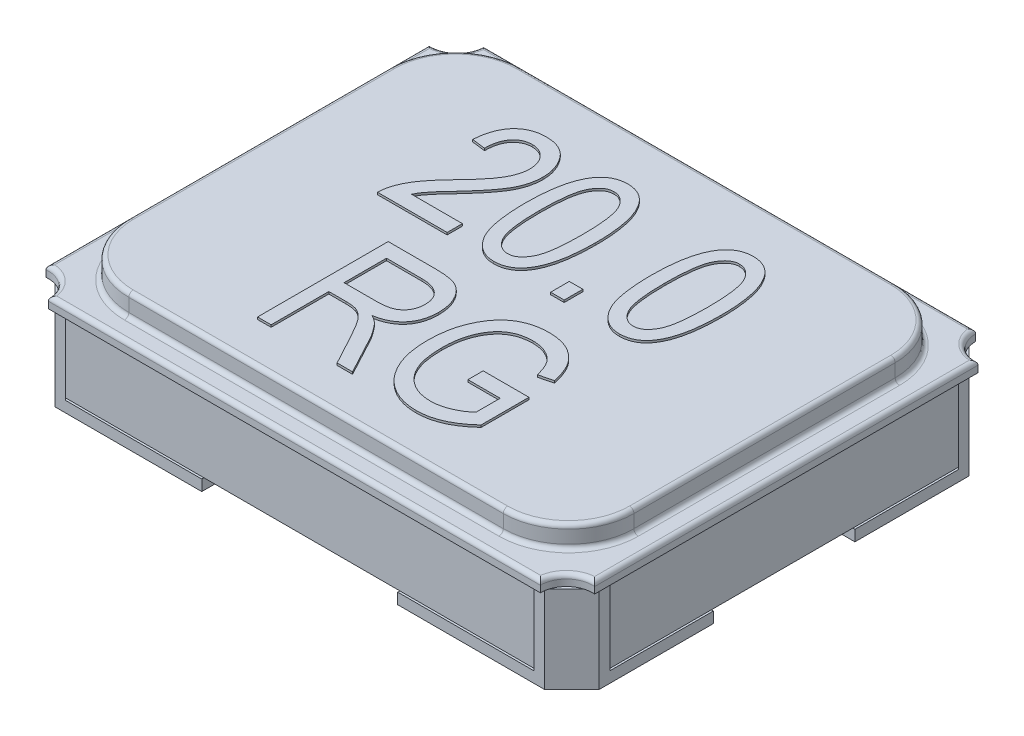
from build123d import *

# Parameters (mm, degrees)
EXTRUDE_2_DEPTH   = 0.05
EXTRUDE_2_2_DEPTH = 0.05
EXTRUDE_2_3_DEPTH = 0.05
EXTRUDE_2_4_DEPTH = 0.05
EXTRUDE_4_DEPTH   = 0.35
EXTRUDE_6_DEPTH   = 0.35
EXTRUDE_9_DEPTH   = 0.05
SKETCH_6_W        = 2.32
SKETCH_6_H        = 1.8
EXTRUDE_10_DEPTH  = 0.1
FILLET_2_R        = 0.3
FILLET_3_R        = 0.02
SKETCH_7_W        = 0.062337663
SKETCH_7_H        = 0.085714286
EXTRUDE_11_DEPTH  = 0.01


with BuildPart() as part:
    # Эскиз2 → Вытянуть2 (new body)
    with BuildSketch(Plane(origin=(0, 0, 0), x_dir=(1, 0, 0), z_dir=(0, 1, 0))):
        Polygon((-1.25, 0.325), (-0.45, 0.325), (-0.45, 0.975), (-1.125, 0.975), (-1.25, 0.85), align=None)
    extrude(amount=EXTRUDE_2_DEPTH)



with BuildPart() as body_2:
    # Эскиз2 → Extrude 2 2 (new body)
    with BuildSketch(Plane(origin=(0, 0, 0), x_dir=(1, 0, 0), z_dir=(0, 1, 0))):
        Polygon((0.45, 0.325), (0.45, 0.975), (1.125, 0.975), (1.25, 0.85), (1.25, 0.325), align=None)
    extrude(amount=EXTRUDE_2_2_DEPTH)


with BuildPart() as body_3:
    # Эскиз2 → Extrude 2 3 (new body)
    with BuildSketch(Plane(origin=(0, 0, 0), x_dir=(1, 0, 0), z_dir=(0, 1, 0))):
        Polygon((-1.25, -0.85), (-1.25, -0.325), (-0.734, -0.325), (-0.45, -0.55575), (-0.45, -0.975), (-1.125, -0.975), align=None)
    extrude(amount=EXTRUDE_2_3_DEPTH)


with BuildPart() as body_4:
    # Эскиз2 → Extrude 2 4 (new body)
    with BuildSketch(Plane(origin=(0, 0, 0), x_dir=(1, 0, 0), z_dir=(0, 1, 0))):
        Polygon((1.25, -0.325), (0.45, -0.325), (0.45, -0.975), (1.125, -0.975), (1.25, -0.85), align=None)
    extrude(amount=EXTRUDE_2_4_DEPTH)


with BuildPart() as part_1:
    add(part.part)

    add(body_2.part)  # Вытянуть4 merges body 2

    add(body_3.part)  # Вытянуть4 merges body 3

    add(body_4.part)  # Вытянуть4 merges body 4
    # Эскиз3 → Вытянуть4 (add)
    with BuildSketch(Plane(origin=(-0.45, 0.05, 0.975), x_dir=(-1, 0, 0), z_dir=(0, 1, 0))):
        Polygon((0.8, -1.825), (0.675, -1.95), (0.625, -1.95), (0.8, -1.775), align=None)
        Polygon((-1.7, -1.775), (-1.7, -1.825), (-1.575, -1.95), (-1.525, -1.95), align=None)
        Polygon((-1.7, -0.125), (-1.575, 0), (-1.525, 0), (-1.7, -0.175), align=None)
        Polygon((0.8, -0.175), (0.8, -0.125), (0.675, 0), (0.625, 0), align=None)
    extrude(amount=EXTRUDE_4_DEPTH)



with BuildPart() as body_2_2:
    # Эскиз4 → Вытянуть6 (new body)
    with BuildSketch(Plane(origin=(-0.45, 0.05, 0.975), x_dir=(-1, 0, 0), z_dir=(0, 1, 0))):
        Polygon((-1.690494047, -1.784505953), (-1.53909114, -1.93590886), (0.65, -1.925), (0.79, -1.785), (0.79, -0.165), (0.635, -0.01), (-1.535, -0.01), (-1.690494047, -0.165494047), align=None)
    extrude(amount=EXTRUDE_6_DEPTH)


with BuildPart() as part_2:
    add(part_1.part)

    add(body_2_2.part)  # Вытянуть9 merges body 2 2
    # Эскиз5 → Вытянуть9 (add)
    with BuildSketch(Plane(origin=(0, 0.4, 0.965), x_dir=(-1, 0, 0), z_dir=(0, 1, 0))):
        with BuildLine():
            Line((1.13, 0.035), (-1.13, 0.035))
            ThreePointArc((-1.13, 0.035), (-1.168759616, -0.053317609), (-1.26, -0.084582607))
            Line((-1.26, -0.084582607), (-1.26, -1.845417393))
            ThreePointArc((-1.26, -1.845417393), (-1.168759616, -1.876682391), (-1.13, -1.965))
            Line((-1.13, -1.965), (1.13, -1.965))
            ThreePointArc((1.13, -1.965), (1.168759616, -1.876682391), (1.26, -1.845417393))
            Line((1.26, -1.845417393), (1.26, -0.084582607))
            ThreePointArc((1.26, -0.084582607), (1.168759616, -0.053317609), (1.13, 0.035))
        make_face()
    extrude(amount=EXTRUDE_9_DEPTH)

    # Эскиз6 → Вытянуть10 (add)
    with BuildSketch(Plane(origin=(0, 0.45, 0), x_dir=(1, 0, 0), z_dir=(0, 1, 0))):
        Rectangle(SKETCH_6_W, SKETCH_6_H)
    extrude(amount=EXTRUDE_10_DEPTH)

    # Скругление2
    fillet_2_edges = [part_2.edges().sort_by_distance(p)[0] for p in [
        (-1.16, 0.5, -0.9),
        (-1.16, 0.5, 0.9),
        (1.16, 0.5, 0.9),
        (1.16, 0.5, -0.9),
    ]]
    fillet(fillet_2_edges, radius=FILLET_2_R)

    # Скругление3
    fillet_3_edges = [part_2.edges().sort_by_distance(p)[0] for p in [
        (0, 0.45, -0.9),
        (0, 0.55, -0.9),
        (1.16, 0.45, 0),
        (1.16, 0.55, 0),
        (-1.16, 0.55, 0),
        (0, 0.55, 0.9),
        (-1.072132034, 0.55, 0.812132034),
        (-1.072132034, 0.55, -0.812132034),
        (1.072132034, 0.55, 0.812132034),
        (1.072132034, 0.55, -0.812132034),
        (0, 0.45, 0.9),
        (-1.16, 0.45, 0),
        (1.072132034, 0.45, -0.812132034),
        (1.072132034, 0.45, 0.812132034),
        (-1.072132034, 0.45, -0.812132034),
        (-1.072132034, 0.45, 0.812132034),
        (-1.168759616, 0.45, 0.911682391),
        (0, 0.45, 1),
        (1.168759616, 0.45, 0.911682391),
        (1.26, 0.45, 0),
        (1.168759616, 0.45, -0.911682391),
        (0, 0.45, -1),
        (-1.168759616, 0.45, -0.911682391),
        (-1.26, 0.45, 0),
    ]]
    fillet(fillet_3_edges, radius=FILLET_3_R)

    # Эскиз7 → Вытянуть11 (add)
    # profile 1 of 6: a face of its own
    with BuildSketch(Plane(origin=(0, 0.55, 0), x_dir=(-1, 0, 0), z_dir=(0, 1, 0))):
        with BuildLine():
            Line((0.357321209, -0.129572333), (0.357321209, -0.059442463))
            Line((0.357321209, -0.059442463), (0.676801728, -0.059442463))
            add(Edge.make_bspline(
                [(0.676801728, -0.059442463), (0.676816521, -0.063096523), (0.67684649, -0.070499707), (0.67585011, -0.081786516), (0.673802963, -0.093346584), (0.671188963, -0.105334125), (0.667482605, -0.117591483), (0.662945301, -0.130178185), (0.65759182, -0.143063022), (0.651322824, -0.156321793), (0.643999464, -0.170083755), (0.635152749, -0.184282726), (0.625043347, -0.199182487), (0.61342633, -0.214597237), (0.600510699, -0.230673489), (0.586232714, -0.247336784), (0.570652004, -0.264678682), (0.559548992, -0.276197149), (0.553830949, -0.282129151)],
                knots=[0, 0, 0, 0, 0.672196011, 1.361880106, 2.081368845, 2.831486093, 3.618364569, 4.435734711, 5.292876118, 6.184871288, 7.133796945, 8.159796293, 9.26180684, 10.446293416, 11.710635831, 13.056147575, 14.483918136, 16, 16, 16, 16], degree=3))
            add(Edge.make_bspline(
                [(0.553830949, -0.282129151), (0.547186493, -0.289000984), (0.534393111, -0.302232163), (0.516393988, -0.321773797), (0.500017502, -0.339919892), (0.485672479, -0.357094986), (0.472816366, -0.372779195), (0.461934396, -0.387477783), (0.452791596, -0.40089921), (0.443159894, -0.416895148), (0.433870902, -0.435828175), (0.425915042, -0.458008816), (0.420604634, -0.479363677), (0.419967988, -0.493464469), (0.419658871, -0.50031097)],
                knots=[0, 0, 0, 0, 1.312411154, 2.526945595, 3.64776648, 4.668054202, 5.599250703, 6.431783916, 7.178281792, 7.828133401, 8.994463432, 10.06613924, 11.061032878, 12, 12, 12, 12], degree=3))
            add(Edge.make_bspline(
                [(0.419658871, -0.50031097), (0.419700996, -0.504090661), (0.41978327, -0.511472793), (0.421245337, -0.522246305), (0.423237349, -0.532532448), (0.426199497, -0.542250746), (0.429811206, -0.551527994), (0.434525527, -0.560140103), (0.439837386, -0.568366659), (0.446059459, -0.575870788), (0.452854652, -0.582642523), (0.460034645, -0.588704286), (0.467718628, -0.593659056), (0.475748726, -0.597763197), (0.484172923, -0.600903455), (0.492969968, -0.603256376), (0.502166787, -0.60459308), (0.508412861, -0.604794695), (0.511582572, -0.604897009)],
                knots=[0, 0, 0, 0, 1.164230772, 2.273864494, 3.346188882, 4.391230338, 5.401926325, 6.409519631, 7.412440917, 8.416921958, 9.407829897, 10.36743554, 11.307926244, 12.220023309, 13.142615873, 14.07432652, 15.022773578, 16, 16, 16, 16], degree=3))
            add(Edge.make_bspline(
                [(0.511582572, -0.604897009), (0.515000078, -0.60482542), (0.521671204, -0.604685675), (0.531393779, -0.602945008), (0.540713753, -0.600623717), (0.549513959, -0.597016166), (0.5579072, -0.592476575), (0.565760696, -0.586877014), (0.57319112, -0.580310265), (0.58009113, -0.572769325), (0.586453474, -0.564312349), (0.591771569, -0.554795075), (0.596470816, -0.54452245), (0.600167429, -0.533320988), (0.603137319, -0.521275566), (0.605102153, -0.508355186), (0.606549344, -0.494580504), (0.606630269, -0.485095983), (0.606671858, -0.480221684)],
                knots=[0, 0, 0, 0, 0.928796924, 1.81305423, 2.681021375, 3.538312184, 4.39332334, 5.272808506, 6.156996835, 7.087171748, 8.050270225, 9.029757968, 10.048018956, 11.120254801, 12.234609712, 13.420296851, 14.674234959, 16, 16, 16, 16], degree=3))
            Line((0.606671858, -0.480221684), (0.669009521, -0.488013892))
            add(Edge.make_bspline(
                [(0.669009521, -0.488013892), (0.668367114, -0.49524769), (0.667120816, -0.509281588), (0.663850625, -0.529597692), (0.659313545, -0.548447917), (0.653924775, -0.566017964), (0.647155522, -0.582097881), (0.639536587, -0.596982074), (0.630626982, -0.610411651), (0.620612728, -0.622409122), (0.609577743, -0.632929291), (0.597722675, -0.642072677), (0.585103306, -0.650002626), (0.571542025, -0.656297331), (0.557128539, -0.661205459), (0.541916568, -0.664714559), (0.525845207, -0.66680733), (0.514876191, -0.66709012), (0.509269261, -0.667234671)],
                knots=[0, 0, 0, 0, 1.296016433, 2.514330702, 3.668705393, 4.754684394, 5.790583066, 6.778804856, 7.735156204, 8.660808185, 9.562568342, 10.450784178, 11.329227516, 12.217177451, 13.112894374, 14.042449809, 14.999377131, 16, 16, 16, 16], degree=3))
            add(Edge.make_bspline(
                [(0.509269261, -0.667234671), (0.503215025, -0.66705828), (0.491426421, -0.666714819), (0.474274014, -0.664416802), (0.458228551, -0.660455806), (0.443406331, -0.654631952), (0.429646213, -0.647479615), (0.417072647, -0.638596687), (0.405698729, -0.628036297), (0.39558595, -0.615998276), (0.386646347, -0.603007525), (0.37884661, -0.589422163), (0.372080794, -0.575469128), (0.366793159, -0.560992675), (0.362377409, -0.546187218), (0.359603341, -0.53082829), (0.357650417, -0.515093115), (0.357431565, -0.504456783), (0.357321209, -0.499093437)],
                knots=[0, 0, 0, 0, 1.141316638, 2.222333051, 3.255980828, 4.24919085, 5.217781249, 6.173073686, 7.14226832, 8.135684626, 9.131102602, 10.111468148, 11.086834621, 12.050425614, 13.014198859, 13.995608887, 14.989290351, 16, 16, 16, 16], degree=3))
            add(Edge.make_bspline(
                [(0.357321209, -0.499093437), (0.357424886, -0.494261203), (0.35763089, -0.484659692), (0.358979233, -0.470335356), (0.361334792, -0.456196977), (0.364475501, -0.442151812), (0.368608214, -0.428272821), (0.373784157, -0.414603169), (0.379762018, -0.401070547), (0.386686403, -0.387416002), (0.395026467, -0.373338215), (0.404927948, -0.358366408), (0.416536438, -0.342338924), (0.429706838, -0.325178689), (0.444459309, -0.306889566), (0.460923068, -0.287544532), (0.479065407, -0.267120247), (0.491836253, -0.253253344), (0.498433222, -0.24609019)],
                knots=[0, 0, 0, 0, 0.780472836, 1.550777384, 2.321277132, 3.094115446, 3.873899828, 4.657970281, 5.45330333, 6.262401287, 7.129160449, 8.094534006, 9.160566029, 10.324774858, 11.58803391, 12.955259569, 14.427194379, 16, 16, 16, 16], degree=3))
            add(Edge.make_bspline(
                [(0.498433222, -0.24609019), (0.502625439, -0.241637041), (0.510637103, -0.233126716), (0.521905602, -0.220782256), (0.532231382, -0.209711405), (0.54126346, -0.19963391), (0.549295121, -0.19076562), (0.555897036, -0.182816301), (0.561573557, -0.176173228), (0.56985478, -0.1655282), (0.580305975, -0.150512912), (0.5875765, -0.136391552), (0.591087443, -0.129572333)],
                knots=[0, 0, 0, 0, 1.227426371, 2.345710398, 3.354421158, 4.265580894, 5.061720194, 5.755250507, 6.339260457, 6.815034732, 8.461977265, 10, 10, 10, 10], degree=3))
            Line((0.591087443, -0.129572333), (0.357321209, -0.129572333))
        make_face()
    # profile 2 of 6: a face of its own
    with BuildSketch(Plane(origin=(0, 0.55, 0), x_dir=(-1, 0, 0), z_dir=(0, 1, 0))):
        with BuildLine():
            add(Edge.make_bspline(
                [(0.294983547, -0.359198957), (0.294884569, -0.371458245), (0.294692379, -0.395262834), (0.292705706, -0.429788615), (0.289572998, -0.462043654), (0.285310134, -0.491983415), (0.279550263, -0.519616718), (0.272727094, -0.545010269), (0.26444496, -0.568092933), (0.255013592, -0.588883378), (0.244311345, -0.607300741), (0.232302013, -0.623287074), (0.219157823, -0.636973736), (0.204609456, -0.648078008), (0.188879575, -0.656688701), (0.171935298, -0.662845149), (0.153790276, -0.666569831), (0.141267513, -0.667010055), (0.134878027, -0.667234671)],
                knots=[0, 0, 0, 0, 1.522177082, 2.955701814, 4.292601031, 5.54555501, 6.7088804, 7.795771162, 8.808034672, 9.750647735, 10.627079958, 11.44753433, 12.228026558, 12.97593222, 13.711165822, 14.446140298, 15.20717461, 16, 16, 16, 16], degree=3))
            add(Edge.make_bspline(
                [(0.134878027, -0.667234671), (0.12918032, -0.667069707), (0.117983968, -0.666745542), (0.101726679, -0.663535616), (0.086311011, -0.658750451), (0.071961166, -0.651688755), (0.058514779, -0.642697268), (0.046131626, -0.631636153), (0.034491293, -0.618740899), (0.027863383, -0.608962216), (0.024447832, -0.603922983)],
                knots=[0, 0, 0, 0, 1.02455918, 2.013323352, 2.972239719, 3.92313388, 4.881632631, 5.875512573, 6.905191138, 8, 8, 8, 8], degree=3))
            add(Edge.make_bspline(
                [(0.024447832, -0.603922983), (0.02048164, -0.597142026), (0.012233526, -0.583040312), (0.002403764, -0.559408785), (-0.005975715, -0.533005412), (-0.01266939, -0.503704125), (-0.017975685, -0.471621176), (-0.021827392, -0.436711839), (-0.024141847, -0.39892216), (-0.024375759, -0.372757589), (-0.024496973, -0.359198957)],
                knots=[0, 0, 0, 0, 0.745775943, 1.550919754, 2.425386613, 3.375801173, 4.404149056, 5.513981972, 6.711731112, 8, 8, 8, 8], degree=3))
            add(Edge.make_bspline(
                [(-0.024496973, -0.359198957), (-0.024398894, -0.347020679), (-0.024208486, -0.323378001), (-0.022208389, -0.289057019), (-0.019105523, -0.256958646), (-0.014757892, -0.227126447), (-0.009257902, -0.199525639), (-0.002289677, -0.174236428), (0.005758765, -0.15112921), (0.01526618, -0.130342922), (0.02594111, -0.1118449), (0.037855159, -0.095721375), (0.051173449, -0.082174061), (0.065582673, -0.070901011), (0.081426431, -0.062328368), (0.098367683, -0.056024816), (0.116617281, -0.052313531), (0.129179221, -0.051874801), (0.135608547, -0.051650255)],
                knots=[0, 0, 0, 0, 1.513837482, 2.938935398, 4.272350439, 5.521752746, 6.68539866, 7.768673685, 8.780403913, 9.72410058, 10.605895827, 11.431327849, 12.209109083, 12.960945015, 13.697023823, 14.439318735, 15.201227913, 16, 16, 16, 16], degree=3))
            add(Edge.make_bspline(
                [(0.135608547, -0.051650255), (0.141343895, -0.051867623), (0.152620237, -0.052294991), (0.169143075, -0.055476608), (0.184757673, -0.061127541), (0.199719478, -0.06861309), (0.213668911, -0.078588085), (0.226980824, -0.090449111), (0.239178143, -0.104764313), (0.25095916, -0.121047288), (0.26146741, -0.14014678), (0.270568487, -0.162238156), (0.278155986, -0.187454472), (0.284258298, -0.21580717), (0.289048835, -0.247241423), (0.292545855, -0.281778801), (0.294569698, -0.319442505), (0.294841994, -0.345600661), (0.294983547, -0.359198957)],
                knots=[0, 0, 0, 0, 0.713939269, 1.403684939, 2.084525483, 2.776045801, 3.479790818, 4.213328499, 4.990539752, 5.816442109, 6.712155869, 7.697513436, 8.78604652, 9.986360954, 11.305640346, 12.743160741, 14.306934742, 16, 16, 16, 16], degree=3))
        make_face()
        with BuildLine():
            add(Edge.make_bspline(
                [(0.232645884, -0.359442463), (0.232535973, -0.347753389), (0.232325629, -0.325383233), (0.23119874, -0.293338714), (0.22902237, -0.264341114), (0.226042464, -0.238332174), (0.222212761, -0.215313557), (0.217597264, -0.195239495), (0.211933513, -0.178228477), (0.205405635, -0.16398325), (0.198055972, -0.15214933), (0.190406096, -0.141945992), (0.182224387, -0.133316958), (0.173486819, -0.126298351), (0.164308328, -0.120711484), (0.154567226, -0.116783985), (0.144330821, -0.11436527), (0.137326341, -0.1141147), (0.133782248, -0.113987918)],
                knots=[0, 0, 0, 0, 1.930680258, 3.694870612, 5.294765573, 6.732327541, 8.017244644, 9.14720992, 10.130763445, 10.973463911, 11.728776188, 12.427251247, 13.076760965, 13.687074849, 14.273357039, 14.844695938, 15.415444712, 16, 16, 16, 16], degree=3))
            add(Edge.make_bspline(
                [(0.133782248, -0.113987918), (0.13043691, -0.114102993), (0.123775809, -0.114332127), (0.11407098, -0.116973699), (0.104726891, -0.120799674), (0.09591265, -0.126499118), (0.087559524, -0.133700743), (0.079592017, -0.142478741), (0.072053932, -0.152761466), (0.064868102, -0.164757605), (0.05827062, -0.179054945), (0.05284242, -0.196210675), (0.048109775, -0.216229774), (0.044495665, -0.239200443), (0.04144666, -0.265068225), (0.03929671, -0.29390788), (0.03816001, -0.325707535), (0.037950182, -0.34787503), (0.037840689, -0.359442463)],
                knots=[0, 0, 0, 0, 0.5561996, 1.107481919, 1.665324653, 2.233973471, 2.848122302, 3.499305928, 4.205575626, 4.970121907, 5.826722289, 6.823612291, 7.963984009, 9.252947287, 10.697030014, 12.304913753, 14.07183163, 16, 16, 16, 16], degree=3))
            add(Edge.make_bspline(
                [(0.037840689, -0.359442463), (0.037951527, -0.371131487), (0.038164028, -0.393542099), (0.039281756, -0.4256278), (0.041473955, -0.454704955), (0.044433186, -0.480757145), (0.048275695, -0.503814115), (0.052886049, -0.523890989), (0.058562364, -0.540893821), (0.065038617, -0.555132175), (0.072481673, -0.566862182), (0.08003199, -0.577103507), (0.088431827, -0.585572869), (0.097223778, -0.592555962), (0.106447747, -0.598205923), (0.11632561, -0.602118632), (0.126727893, -0.604508258), (0.133850872, -0.604766881), (0.137434845, -0.604897009)],
                knots=[0, 0, 0, 0, 1.926017154, 3.692628624, 5.288659415, 6.729390826, 8.011204514, 9.138440624, 10.119618606, 10.960283728, 11.708082919, 12.404870975, 13.05267392, 13.666742433, 14.251608596, 14.827770794, 15.41018532, 16, 16, 16, 16], degree=3))
            add(Edge.make_bspline(
                [(0.137434845, -0.604897009), (0.140779668, -0.604782743), (0.147400319, -0.604556568), (0.157003788, -0.60194674), (0.166196517, -0.597984916), (0.174996932, -0.592461784), (0.183327046, -0.585295139), (0.191139211, -0.576520644), (0.19854137, -0.566207597), (0.205775139, -0.554226887), (0.212304025, -0.539908223), (0.217642076, -0.522741305), (0.222354168, -0.502727054), (0.226183437, -0.479746115), (0.228978365, -0.453804357), (0.231208969, -0.424979422), (0.232321072, -0.393176708), (0.232534509, -0.371009662), (0.232645884, -0.359442463)],
                knots=[0, 0, 0, 0, 0.557130238, 1.102768586, 1.649079731, 2.224414864, 2.830037934, 3.477754783, 4.181203309, 4.947028836, 5.811221183, 6.801235864, 7.943515661, 9.242435973, 10.688157038, 12.298731102, 14.068605401, 16, 16, 16, 16], degree=3))
        make_face(mode=Mode.SUBTRACT)
    # profile 3 of 6: a face of its own
    with BuildSketch(Plane(origin=(0, 0.55, 0), x_dir=(-1, 0, 0), z_dir=(0, 1, 0))):
        with Locations((-0.149172297, -0.102299606)):
            Rectangle(SKETCH_7_W, SKETCH_7_H)
    # profile 4 of 6: a face of its own
    with BuildSketch(Plane(origin=(0, 0.55, 0), x_dir=(-1, 0, 0), z_dir=(0, 1, 0))):
        with BuildLine():
            add(Edge.make_bspline(
                [(-0.28163983, -0.359198957), (-0.281738808, -0.371458245), (-0.281930998, -0.395262834), (-0.283917671, -0.429788615), (-0.287050379, -0.462043654), (-0.291313242, -0.491983415), (-0.297073113, -0.519616718), (-0.303896283, -0.545010269), (-0.312178417, -0.568092933), (-0.321609785, -0.588883378), (-0.332312032, -0.607300741), (-0.344321363, -0.623287074), (-0.357465553, -0.636973736), (-0.37201392, -0.648078008), (-0.387743801, -0.656688701), (-0.404688079, -0.662845149), (-0.422833101, -0.666569831), (-0.435355864, -0.667010055), (-0.44174535, -0.667234671)],
                knots=[0, 0, 0, 0, 1.522177082, 2.955701814, 4.292601031, 5.54555501, 6.7088804, 7.795771162, 8.808034672, 9.750647735, 10.627079958, 11.44753433, 12.228026558, 12.97593222, 13.711165822, 14.446140298, 15.20717461, 16, 16, 16, 16], degree=3))
            add(Edge.make_bspline(
                [(-0.44174535, -0.667234671), (-0.447443056, -0.667069707), (-0.458639409, -0.666745542), (-0.474896698, -0.663535616), (-0.490312366, -0.658750451), (-0.504662211, -0.651688755), (-0.518108597, -0.642697268), (-0.53049175, -0.631636153), (-0.542132084, -0.618740899), (-0.548759994, -0.608962216), (-0.552175544, -0.603922983)],
                knots=[0, 0, 0, 0, 1.02455918, 2.013323352, 2.972239719, 3.92313388, 4.881632631, 5.875512573, 6.905191138, 8, 8, 8, 8], degree=3))
            add(Edge.make_bspline(
                [(-0.552175544, -0.603922983), (-0.556141736, -0.597142026), (-0.564389851, -0.583040312), (-0.574219612, -0.559408785), (-0.582599091, -0.533005412), (-0.589292767, -0.503704125), (-0.594599062, -0.471621176), (-0.598450769, -0.436711839), (-0.600765224, -0.39892216), (-0.600999135, -0.372757589), (-0.60112035, -0.359198957)],
                knots=[0, 0, 0, 0, 0.745775943, 1.550919754, 2.425386613, 3.375801173, 4.404149056, 5.513981972, 6.711731112, 8, 8, 8, 8], degree=3))
            add(Edge.make_bspline(
                [(-0.60112035, -0.359198957), (-0.601022271, -0.347020679), (-0.600831863, -0.323378001), (-0.598831765, -0.289057019), (-0.5957289, -0.256958646), (-0.591381269, -0.227126447), (-0.585881279, -0.199525639), (-0.578913054, -0.174236428), (-0.570864612, -0.15112921), (-0.561357197, -0.130342922), (-0.550682266, -0.1118449), (-0.538768217, -0.095721375), (-0.525449928, -0.082174061), (-0.511040703, -0.070901011), (-0.495196946, -0.062328368), (-0.478255693, -0.056024816), (-0.460006095, -0.052313531), (-0.447444155, -0.051874801), (-0.44101483, -0.051650255)],
                knots=[0, 0, 0, 0, 1.513837482, 2.938935398, 4.272350439, 5.521752746, 6.68539866, 7.768673685, 8.780403913, 9.72410058, 10.605895827, 11.431327849, 12.209109083, 12.960945015, 13.697023823, 14.439318735, 15.201227913, 16, 16, 16, 16], degree=3))
            add(Edge.make_bspline(
                [(-0.44101483, -0.051650255), (-0.435279481, -0.051867623), (-0.42400314, -0.052294991), (-0.407480302, -0.055476608), (-0.391865703, -0.061127541), (-0.376903899, -0.06861309), (-0.362954465, -0.078588085), (-0.349642552, -0.090449111), (-0.337445234, -0.104764313), (-0.325664217, -0.121047288), (-0.315155966, -0.14014678), (-0.306054889, -0.162238156), (-0.298467391, -0.187454472), (-0.292365079, -0.21580717), (-0.287574542, -0.247241423), (-0.284077521, -0.281778801), (-0.282053679, -0.319442505), (-0.281781383, -0.345600661), (-0.28163983, -0.359198957)],
                knots=[0, 0, 0, 0, 0.713939269, 1.403684939, 2.084525483, 2.776045801, 3.479790818, 4.213328499, 4.990539752, 5.816442109, 6.712155869, 7.697513436, 8.78604652, 9.986360954, 11.305640346, 12.743160741, 14.306934742, 16, 16, 16, 16], degree=3))
        make_face()
        with BuildLine():
            add(Edge.make_bspline(
                [(-0.343977492, -0.359442463), (-0.344087403, -0.347753389), (-0.344297747, -0.325383233), (-0.345424636, -0.293338714), (-0.347601007, -0.264341114), (-0.350580913, -0.238332174), (-0.354410615, -0.215313557), (-0.359026112, -0.195239495), (-0.364689864, -0.178228477), (-0.371217741, -0.16398325), (-0.378567405, -0.15214933), (-0.38621728, -0.141945992), (-0.394398989, -0.133316958), (-0.403136557, -0.126298351), (-0.412315048, -0.120711484), (-0.422056151, -0.116783985), (-0.432292556, -0.11436527), (-0.439297035, -0.1141147), (-0.442841129, -0.113987918)],
                knots=[0, 0, 0, 0, 1.930680258, 3.694870612, 5.294765573, 6.732327541, 8.017244644, 9.14720992, 10.130763445, 10.973463911, 11.728776188, 12.427251247, 13.076760965, 13.687074849, 14.273357039, 14.844695938, 15.415444712, 16, 16, 16, 16], degree=3))
            add(Edge.make_bspline(
                [(-0.442841129, -0.113987918), (-0.446186467, -0.114102993), (-0.452847568, -0.114332127), (-0.462552397, -0.116973699), (-0.471896486, -0.120799674), (-0.480710727, -0.126499118), (-0.489063853, -0.133700743), (-0.49703136, -0.142478741), (-0.504569444, -0.152761466), (-0.511755275, -0.164757605), (-0.518352757, -0.179054945), (-0.523780957, -0.196210675), (-0.528513601, -0.216229774), (-0.532127712, -0.239200443), (-0.535176717, -0.265068225), (-0.537326666, -0.29390788), (-0.538463367, -0.325707535), (-0.538673195, -0.34787503), (-0.538782687, -0.359442463)],
                knots=[0, 0, 0, 0, 0.5561996, 1.107481919, 1.665324653, 2.233973471, 2.848122302, 3.499305928, 4.205575626, 4.970121907, 5.826722289, 6.823612291, 7.963984009, 9.252947287, 10.697030014, 12.304913753, 14.07183163, 16, 16, 16, 16], degree=3))
            add(Edge.make_bspline(
                [(-0.538782687, -0.359442463), (-0.53867185, -0.371131487), (-0.538459349, -0.393542099), (-0.537341621, -0.4256278), (-0.535149422, -0.454704955), (-0.53219019, -0.480757145), (-0.528347682, -0.503814115), (-0.523737327, -0.523890989), (-0.518061012, -0.540893821), (-0.51158476, -0.555132175), (-0.504141703, -0.566862182), (-0.496591386, -0.577103507), (-0.48819155, -0.585572869), (-0.479399599, -0.592555962), (-0.47017563, -0.598205923), (-0.460297766, -0.602118632), (-0.449895483, -0.604508258), (-0.442772504, -0.604766881), (-0.439188531, -0.604897009)],
                knots=[0, 0, 0, 0, 1.926017154, 3.692628624, 5.288659415, 6.729390826, 8.011204514, 9.138440624, 10.119618606, 10.960283728, 11.708082919, 12.404870975, 13.05267392, 13.666742433, 14.251608596, 14.827770794, 15.41018532, 16, 16, 16, 16], degree=3))
            add(Edge.make_bspline(
                [(-0.439188531, -0.604897009), (-0.435843709, -0.604782743), (-0.429223057, -0.604556568), (-0.419619589, -0.60194674), (-0.410426859, -0.597984916), (-0.401626445, -0.592461784), (-0.393296331, -0.585295139), (-0.385484166, -0.576520644), (-0.378082006, -0.566207597), (-0.370848237, -0.554226887), (-0.364319352, -0.539908223), (-0.358981301, -0.522741305), (-0.354269209, -0.502727054), (-0.35043994, -0.479746115), (-0.347645012, -0.453804357), (-0.345414407, -0.424979422), (-0.344302305, -0.393176708), (-0.344088868, -0.371009662), (-0.343977492, -0.359442463)],
                knots=[0, 0, 0, 0, 0.557130238, 1.102768586, 1.649079731, 2.224414864, 2.830037934, 3.477754783, 4.181203309, 4.947028836, 5.811221183, 6.801235864, 7.943515661, 9.242435973, 10.688157038, 12.298731102, 14.068605401, 16, 16, 16, 16], degree=3))
        make_face(mode=Mode.SUBTRACT)
    # profile 5 of 6: a face of its own
    with BuildSketch(Plane(origin=(0, 0.55, 0), x_dir=(-1, 0, 0), z_dir=(0, 1, 0))):
        with BuildLine():
            Line((0.456515873, 0.712228851), (0.456515873, 0.112228851))
            Line((0.456515873, 0.112228851), (0.236142496, 0.112228851))
            add(Edge.make_bspline(
                [(0.236142496, 0.112228851), (0.230581007, 0.11226018), (0.21981617, 0.112320821), (0.204223706, 0.113221399), (0.189758155, 0.114505822), (0.176397658, 0.116361519), (0.164162705, 0.11854421), (0.153089821, 0.121559313), (0.143090969, 0.124843391), (0.131322091, 0.130270703), (0.11799834, 0.138844897), (0.103509421, 0.151651508), (0.090866852, 0.167563233), (0.079606781, 0.185826001), (0.070362438, 0.206336288), (0.063813546, 0.228702458), (0.059860286, 0.252632489), (0.05936661, 0.26911276), (0.059113276, 0.27756976)],
                knots=[0, 0, 0, 0, 0.957635919, 1.853602921, 2.688875264, 3.457888691, 4.176190018, 4.827208561, 5.432822301, 5.986390625, 7.054747822, 8.148857704, 9.301562339, 10.541054864, 11.836189034, 13.163051712, 14.544194391, 16, 16, 16, 16], degree=3))
            add(Edge.make_bspline(
                [(0.059113276, 0.27756976), (0.059246185, 0.283173865), (0.059505798, 0.294120432), (0.061066742, 0.310166827), (0.063820029, 0.325417527), (0.067910738, 0.339795555), (0.072823906, 0.3534349), (0.079129963, 0.366150118), (0.08641544, 0.378125455), (0.094863259, 0.38926094), (0.104379255, 0.39947957), (0.114868261, 0.408839388), (0.126568943, 0.416952963), (0.139118365, 0.424306381), (0.15273399, 0.430651154), (0.167349073, 0.436007095), (0.183015052, 0.440243302), (0.193838605, 0.442330457), (0.199373016, 0.443397682)],
                knots=[0, 0, 0, 0, 1.121876415, 2.19137531, 3.223949102, 4.219388443, 5.180726412, 6.121767895, 7.055309798, 7.98310721, 8.914383918, 9.846793912, 10.791230962, 11.759648879, 12.755485972, 13.793860249, 14.871933835, 16, 16, 16, 16], degree=3))
            add(Edge.make_bspline(
                [(0.199373016, 0.443397682), (0.195267498, 0.44563561), (0.187462143, 0.449890328), (0.177027035, 0.457145882), (0.167713915, 0.463853527), (0.162587538, 0.468981234), (0.16016847, 0.471400929)],
                knots=[0, 0, 0, 0, 1.159130627, 2.203723279, 3.152361336, 4, 4, 4, 4], degree=3))
            add(Edge.make_bspline(
                [(0.16016847, 0.471400929), (0.155306384, 0.477269662), (0.145527538, 0.489073122), (0.132122296, 0.507904062), (0.11928184, 0.527493508), (0.11174132, 0.541273673), (0.107936328, 0.548227228)],
                knots=[0, 0, 0, 0, 0.982253192, 1.975551771, 2.978451105, 4, 4, 4, 4], degree=3))
            Line((0.107936328, 0.548227228), (0.020152237, 0.712228851))
            Line((0.020152237, 0.712228851), (0.091012626, 0.712228851))
            Line((0.091012626, 0.712228851), (0.160290224, 0.583900929))
            add(Edge.make_bspline(
                [(0.160290224, 0.583900929), (0.163516998, 0.577883485), (0.169689048, 0.566373551), (0.17885677, 0.550036119), (0.1873519, 0.535284897), (0.195264196, 0.522198653), (0.202369715, 0.510643878), (0.209134073, 0.500956483), (0.215035739, 0.492680551), (0.222127666, 0.484162279), (0.230740679, 0.475638539), (0.240625735, 0.466823166), (0.250576401, 0.460049514), (0.260689541, 0.454877315), (0.271826611, 0.451473089), (0.284374554, 0.448924024), (0.298896274, 0.447537771), (0.30919176, 0.447378556), (0.314673341, 0.447293786)],
                knots=[0, 0, 0, 0, 1.483494143, 2.837570132, 4.070207475, 5.181709378, 6.16033008, 7.016386932, 7.748320287, 8.368145667, 9.421904523, 10.378344883, 11.241682452, 12.030373519, 12.836277254, 13.763198992, 14.809069961, 16, 16, 16, 16], degree=3))
            Line((0.314673341, 0.447293786), (0.394178211, 0.447293786))
            Line((0.394178211, 0.447293786), (0.394178211, 0.712228851))
            Line((0.394178211, 0.712228851), (0.456515873, 0.712228851))
        make_face()
        with BuildLine():
            Line((0.394178211, 0.377163916), (0.247952561, 0.377163916))
            add(Edge.make_bspline(
                [(0.247952561, 0.377163916), (0.240440867, 0.377016702), (0.226363218, 0.376740809), (0.206663739, 0.374930102), (0.189827568, 0.37159392), (0.175549911, 0.366885206), (0.163446934, 0.360431252), (0.152903721, 0.352549328), (0.143465188, 0.343212344), (0.135678418, 0.332238557), (0.12920941, 0.320127717), (0.124817174, 0.306861194), (0.121831785, 0.292718681), (0.121579954, 0.282943146), (0.121450938, 0.27793502)],
                knots=[0, 0, 0, 0, 1.472846091, 2.760257298, 3.872921329, 4.831650159, 5.69663992, 6.549651953, 7.404887885, 8.288274496, 9.178088419, 10.086493483, 11.019687313, 12, 12, 12, 12], degree=3))
            add(Edge.make_bspline(
                [(0.121450938, 0.27793502), (0.121561863, 0.274320187), (0.121778115, 0.267272975), (0.122959428, 0.256945935), (0.125138628, 0.247236222), (0.128230831, 0.238109229), (0.132079724, 0.22958365), (0.136911597, 0.221656076), (0.142653614, 0.214401426), (0.149113587, 0.207640161), (0.156464122, 0.201590367), (0.164811873, 0.196552068), (0.173918766, 0.192091053), (0.183881144, 0.18848761), (0.194680078, 0.185665515), (0.206301712, 0.183794507), (0.218743749, 0.182514368), (0.227332159, 0.182411664), (0.23175938, 0.182358721)],
                knots=[0, 0, 0, 0, 1.044945206, 2.037148109, 2.998935724, 3.915084151, 4.817845283, 5.696903301, 6.590859038, 7.486736354, 8.395345577, 9.33279486, 10.298009282, 11.322143252, 12.388977231, 13.518936305, 14.721042082, 16, 16, 16, 16], degree=3))
            Line((0.23175938, 0.182358721), (0.394178211, 0.182358721))
            Line((0.394178211, 0.182358721), (0.394178211, 0.377163916))
        make_face(mode=Mode.SUBTRACT)
    # profile 6 of 6: a face of its own
    with BuildSketch(Plane(origin=(0, 0.55, 0), x_dir=(-1, 0, 0), z_dir=(0, 1, 0))):
        with BuildLine():
            Line((-0.275951659, 0.478462617), (-0.275951659, 0.408332747))
            Line((-0.275951659, 0.408332747), (-0.48634127, 0.408332747))
            Line((-0.48634127, 0.408332747), (-0.48634127, 0.628097357))
            add(Edge.make_bspline(
                [(-0.48634127, 0.628097357), (-0.478340535, 0.635378288), (-0.462681818, 0.649628233), (-0.437721959, 0.668228), (-0.412510199, 0.684206298), (-0.386780651, 0.697214967), (-0.36063932, 0.707368507), (-0.334153685, 0.714757378), (-0.307226821, 0.719150531), (-0.28915734, 0.719730213), (-0.28009127, 0.720021059)],
                knots=[0, 0, 0, 0, 1.121231474, 2.194429093, 3.223167231, 4.213185939, 5.179199031, 6.126736477, 7.060120306, 8, 8, 8, 8], degree=3))
            add(Edge.make_bspline(
                [(-0.28009127, 0.720021059), (-0.274122848, 0.719881982), (-0.262287426, 0.719606191), (-0.244778915, 0.718080186), (-0.227753072, 0.715200321), (-0.211193808, 0.71140337), (-0.195220861, 0.706172198), (-0.179656382, 0.700149429), (-0.16467325, 0.692782223), (-0.15020636, 0.684380034), (-0.136271321, 0.67502419), (-0.1230881, 0.66451065), (-0.110671205, 0.652913592), (-0.098971372, 0.640330978), (-0.087930314, 0.626811976), (-0.0779002, 0.612085628), (-0.06830549, 0.596527844), (-0.059752051, 0.579834649), (-0.051897316, 0.562269527), (-0.045107519, 0.543801141), (-0.039396858, 0.52443146), (-0.034582007, 0.504252219), (-0.031193021, 0.48311066), (-0.028441506, 0.461192359), (-0.026848178, 0.438389015), (-0.026684343, 0.422904946), (-0.02660101, 0.415029176)],
                knots=[0, 0, 0, 0, 0.963769683, 1.911162165, 2.834339437, 3.749810782, 4.651221655, 5.545555403, 6.442286319, 7.343625743, 8.245036616, 9.149656848, 10.062991788, 10.985587531, 11.921948604, 12.878002728, 13.860173613, 14.871251345, 15.903800411, 16.965219181, 18.045343247, 19.162668582, 20.31206171, 21.500282558, 22.728551209, 24, 24, 24, 24], degree=3))
            add(Edge.make_bspline(
                [(-0.02660101, 0.415029176), (-0.026682408, 0.407031349), (-0.026842478, 0.391303443), (-0.028467222, 0.368100072), (-0.031129742, 0.345713022), (-0.034826658, 0.324065187), (-0.039309674, 0.303155654), (-0.045269094, 0.283119698), (-0.052067611, 0.263844379), (-0.05980262, 0.245411711), (-0.068462617, 0.227987735), (-0.077813939, 0.211682752), (-0.087799391, 0.196540578), (-0.098433938, 0.182566648), (-0.109741159, 0.169780755), (-0.12170188, 0.158173889), (-0.134282785, 0.147730841), (-0.147621752, 0.138618865), (-0.161529294, 0.130532305), (-0.176098815, 0.123622693), (-0.191181897, 0.117566206), (-0.206987526, 0.112902744), (-0.223317292, 0.109061463), (-0.240336342, 0.106463466), (-0.257933132, 0.104641494), (-0.269899747, 0.104505447), (-0.275951659, 0.104436643)],
                knots=[0, 0, 0, 0, 1.283113662, 2.523272143, 3.730000566, 4.899049828, 6.046110231, 7.158868481, 8.250466042, 9.324440243, 10.364107375, 11.3705106, 12.338577862, 13.272420617, 14.185809519, 15.074609769, 15.944238297, 16.80583268, 17.663628975, 18.52285769, 19.391095377, 20.268684501, 21.164328724, 22.080753496, 23.029373589, 24, 24, 24, 24], degree=3))
            add(Edge.make_bspline(
                [(-0.275951659, 0.104436643), (-0.284776686, 0.104626654), (-0.301950466, 0.104996422), (-0.326813131, 0.109131485), (-0.350130366, 0.115112484), (-0.371575912, 0.124174667), (-0.391257515, 0.135354692), (-0.409081747, 0.148795681), (-0.425138875, 0.164217666), (-0.436975022, 0.178818775), (-0.445528478, 0.191663876), (-0.451458488, 0.20232969), (-0.457090783, 0.213763367), (-0.462163529, 0.2261175), (-0.466906041, 0.239282165), (-0.471305115, 0.253282214), (-0.475178755, 0.268168084), (-0.477408101, 0.278413768), (-0.478549062, 0.283657422)],
                knots=[0, 0, 0, 0, 1.421356421, 2.766004312, 4.05319741, 5.293867224, 6.507164222, 7.69408069, 8.88335739, 10.08815607, 10.716053702, 11.369380072, 12.054125792, 12.769838882, 13.521154948, 14.309617137, 15.134876386, 16, 16, 16, 16], degree=3))
            Line((-0.478549062, 0.283657422), (-0.4162114, 0.299241838))
            add(Edge.make_bspline(
                [(-0.4162114, 0.299241838), (-0.414182867, 0.291574419), (-0.410363817, 0.277139227), (-0.403118556, 0.257281034), (-0.395402863, 0.240324437), (-0.386412633, 0.226262097), (-0.376246951, 0.214456864), (-0.364715642, 0.204343621), (-0.351776843, 0.1955204), (-0.337563218, 0.187949316), (-0.322043064, 0.182043789), (-0.305578405, 0.17761894), (-0.288127458, 0.175035199), (-0.276203724, 0.174725071), (-0.270107504, 0.174566513)],
                knots=[0, 0, 0, 0, 1.353165462, 2.547559122, 3.604316815, 4.52671073, 5.386326973, 6.255051103, 7.13704315, 8.05435008, 8.997377385, 9.965293206, 10.959720114, 12, 12, 12, 12], degree=3))
            add(Edge.make_bspline(
                [(-0.270107504, 0.174566513), (-0.265640531, 0.174626192), (-0.256851517, 0.174743613), (-0.243910928, 0.175982354), (-0.231436018, 0.178083021), (-0.21943001, 0.180851405), (-0.207834129, 0.184370878), (-0.196825092, 0.188883041), (-0.186273286, 0.194184556), (-0.176130851, 0.200124934), (-0.166443631, 0.206969797), (-0.157332977, 0.214810002), (-0.148614725, 0.223478985), (-0.14053519, 0.23312756), (-0.132768248, 0.243523544), (-0.12563478, 0.254875885), (-0.118898479, 0.267099279), (-0.11274849, 0.280204477), (-0.107093177, 0.294116827), (-0.102286265, 0.308819628), (-0.098118164, 0.324257235), (-0.094691327, 0.340427888), (-0.092235059, 0.357399132), (-0.090204335, 0.37509298), (-0.089154875, 0.393547106), (-0.089011476, 0.406099514), (-0.088938672, 0.412472357)],
                knots=[0, 0, 0, 0, 0.952677145, 1.874444928, 2.769688869, 3.649605989, 4.501257609, 5.351720294, 6.184145198, 7.018593555, 7.856940072, 8.710525669, 9.579816208, 10.476607676, 11.392584021, 12.346086896, 13.334140423, 14.368156984, 15.432428844, 16.53573995, 17.665599422, 18.842284706, 20.059330876, 21.322285137, 22.640527175, 24, 24, 24, 24], degree=3))
            add(Edge.make_bspline(
                [(-0.088938672, 0.412472357), (-0.089099732, 0.422056002), (-0.089412164, 0.440646874), (-0.09188849, 0.467612042), (-0.095798947, 0.492788622), (-0.10151638, 0.51608441), (-0.108773449, 0.537573187), (-0.117825146, 0.557145722), (-0.128389829, 0.574931282), (-0.140664417, 0.590713642), (-0.15421005, 0.604603906), (-0.168754322, 0.616695032), (-0.184177322, 0.62710863), (-0.20077678, 0.635333757), (-0.218235391, 0.642010163), (-0.23675263, 0.646612283), (-0.256229711, 0.649296229), (-0.26953085, 0.649690193), (-0.276316919, 0.649891189)],
                knots=[0, 0, 0, 0, 1.344504073, 2.608141831, 3.796174963, 4.916279424, 5.969770572, 6.973627265, 7.936561481, 8.86602944, 9.772106809, 10.653603516, 11.515946688, 12.376727864, 13.247174307, 14.133861134, 15.047920148, 16, 16, 16, 16], degree=3))
            add(Edge.make_bspline(
                [(-0.276316919, 0.649891189), (-0.282986256, 0.649680761), (-0.296531381, 0.649253391), (-0.316905886, 0.645684603), (-0.337467226, 0.639883979), (-0.357809228, 0.632062327), (-0.377197898, 0.622711724), (-0.394963733, 0.612426741), (-0.410570827, 0.601122985), (-0.419619048, 0.592638795), (-0.424003607, 0.588527552)],
                knots=[0, 0, 0, 0, 0.978162575, 1.986604247, 3.025534994, 4.109442341, 5.180230685, 6.181206173, 7.118654505, 8, 8, 8, 8], degree=3))
            Line((-0.424003607, 0.588527552), (-0.424003607, 0.478462617))
            Line((-0.424003607, 0.478462617), (-0.275951659, 0.478462617))
        make_face()
    extrude(amount=EXTRUDE_11_DEPTH)


solid = part_2.part
